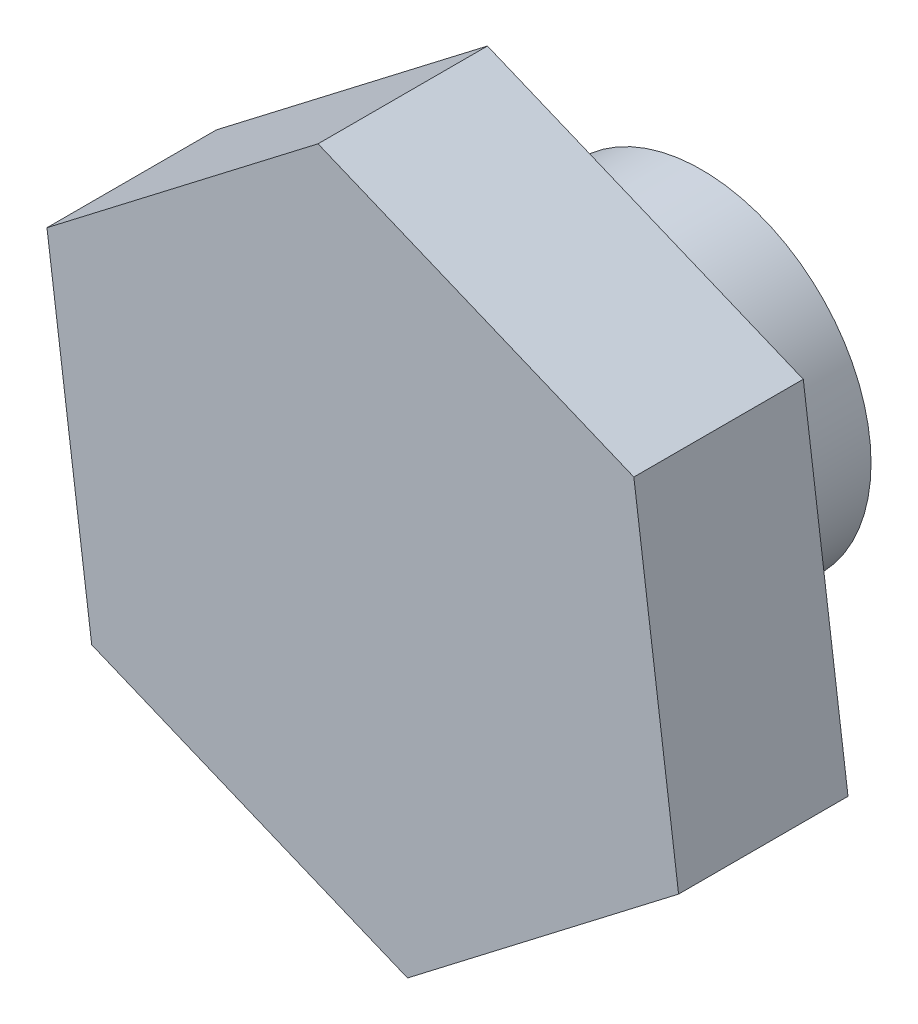
from build123d import *

# Parameters (mm, degrees)
BOSS_EXTRU_1_DEPTH = 25
ESQUISSE2_R        = 25
ESQUISSE2_R_2      = 12.5
BOSS_EXTRU_2_DEPTH = 25


with BuildPart() as part:
    # Esquisse1 → Boss.-Extru.1 (new body)
    with BuildSketch(Plane(origin=(0, 0, 0), x_dir=(0, 1, 0), z_dir=(0, 0, 1))):
        Polygon((19.282032303, 46.602540378), (-30.717967697, 40), (-50, -6.602540378), (-19.282032303, -46.602540378), (30.717967697, -40), (50, 6.602540378), align=None)
    extrude(amount=BOSS_EXTRU_1_DEPTH)

    # Esquisse2 → Boss.-Extru.2 (add)
    with BuildSketch(Plane(origin=(0, 0, 0), x_dir=(0, 1, 0), z_dir=(0, 0, 1))):
        with Locations(Location((0, 0, 0), (0, 0, 270))):
            Circle(ESQUISSE2_R)
        with Locations(Location((0, 0, 0), (0, 0, 270))):
            Circle(ESQUISSE2_R_2, mode=Mode.SUBTRACT)
    extrude(amount=-BOSS_EXTRU_2_DEPTH)


solid = part.part
